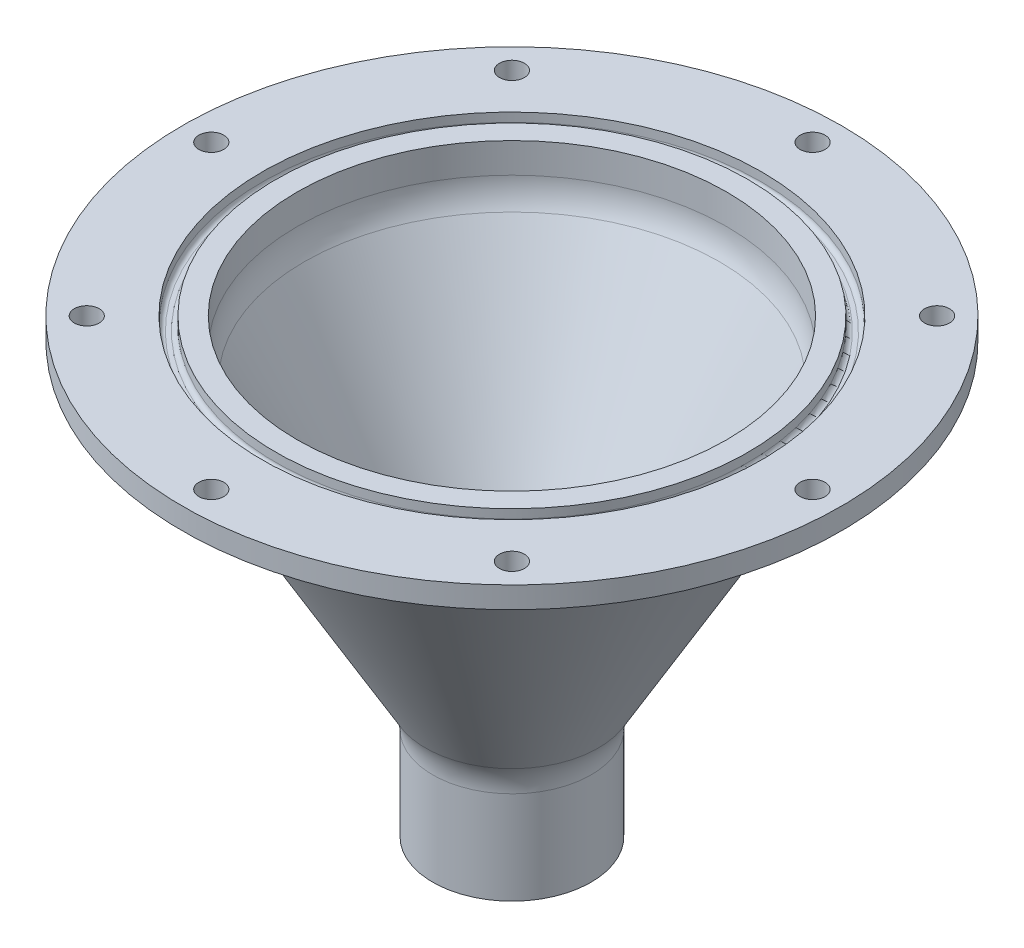
from build123d import *

# Parameters (mm, degrees)
F_4_CLEARANCE_HOLE1_D     = 2.9464
F_4_CLEARANCE_HOLE1_DEPTH = 38.354
F_4_CLEARANCE_HOLE1_TIP   = 0.885187864


with BuildPart() as part:
    # Sketch1 → Revolve1 (revolve)
    with BuildSketch(Plane.XY, mode=Mode.PRIVATE) as revolve1_sk:
        with BuildLine():
            Line((5.55625, 0), (5.55625, 12.019409051))
            ThreePointArc((5.55625, 12.019409051), (5.772621003, 13.662909988), (6.406988686, 15.194409051))
            Line((6.406988686, 15.194409051), (24.549261314, 46.617747008))
            ThreePointArc((24.549261314, 46.617747008), (25.183628997, 48.149246071), (25.4, 49.792747008))
            Line((25.4, 49.792747008), (25.4, 53.34))
            Line((25.4, 53.34), (27.94, 53.34))
            Line((27.94, 53.34), (27.94, 52.29225))
            ThreePointArc((27.94, 52.29225), (28.098089115, 51.910589115), (28.47975, 51.7525))
            Line((28.47975, 51.7525), (28.98775, 51.7525))
            ThreePointArc((28.98775, 51.7525), (29.369410885, 51.910589115), (29.5275, 52.29225))
            Line((29.5275, 52.29225), (29.5275, 53.34))
            Line((29.5275, 53.34), (38.983295256, 53.34))
            Line((38.983295256, 53.34), (38.983295256, 50.8))
            Line((38.983295256, 50.8), (33.196382361, 50.8))
            ThreePointArc((33.196382361, 50.8), (31.608882361, 50.374630657), (30.446751704, 49.2125))
            Line((30.446751704, 49.2125), (10.216988686, 14.173522628))
            ThreePointArc((10.216988686, 14.173522628), (9.582621003, 12.642023564), (9.36625, 10.998522628))
            Line((9.36625, 10.998522628), (9.36625, 0))
            Line((9.36625, 0), (5.55625, 0))
        make_face()
    revolve(revolve1_sk.sketch.rotate(Axis((0, 0, 0), (0, 1, 0)), 90), axis=Axis((0, 0, 0), (0, 1, 0)))

    # #4 Clearance Hole1
    with Locations(Plane(origin=(0, 50.8, 0), x_dir=(-1, 0, 0), z_dir=(0, -1, 0))):
        with Locations((35.56, 0), (25.144717139, -25.144717139), (0, -35.56), (-25.144717139, -25.144717139), (-35.56, 0), (-25.144717139, 25.144717139), (0, 35.56), (25.144717139, 25.144717139), (0, 0)):
            Hole(F_4_CLEARANCE_HOLE1_D / 2, depth=F_4_CLEARANCE_HOLE1_DEPTH)
            with Locations((0, 0, -(F_4_CLEARANCE_HOLE1_DEPTH + F_4_CLEARANCE_HOLE1_TIP / 2))):  # 118° drill point
                Cone(0, F_4_CLEARANCE_HOLE1_D / 2, F_4_CLEARANCE_HOLE1_TIP, mode=Mode.SUBTRACT)


solid = part.part
